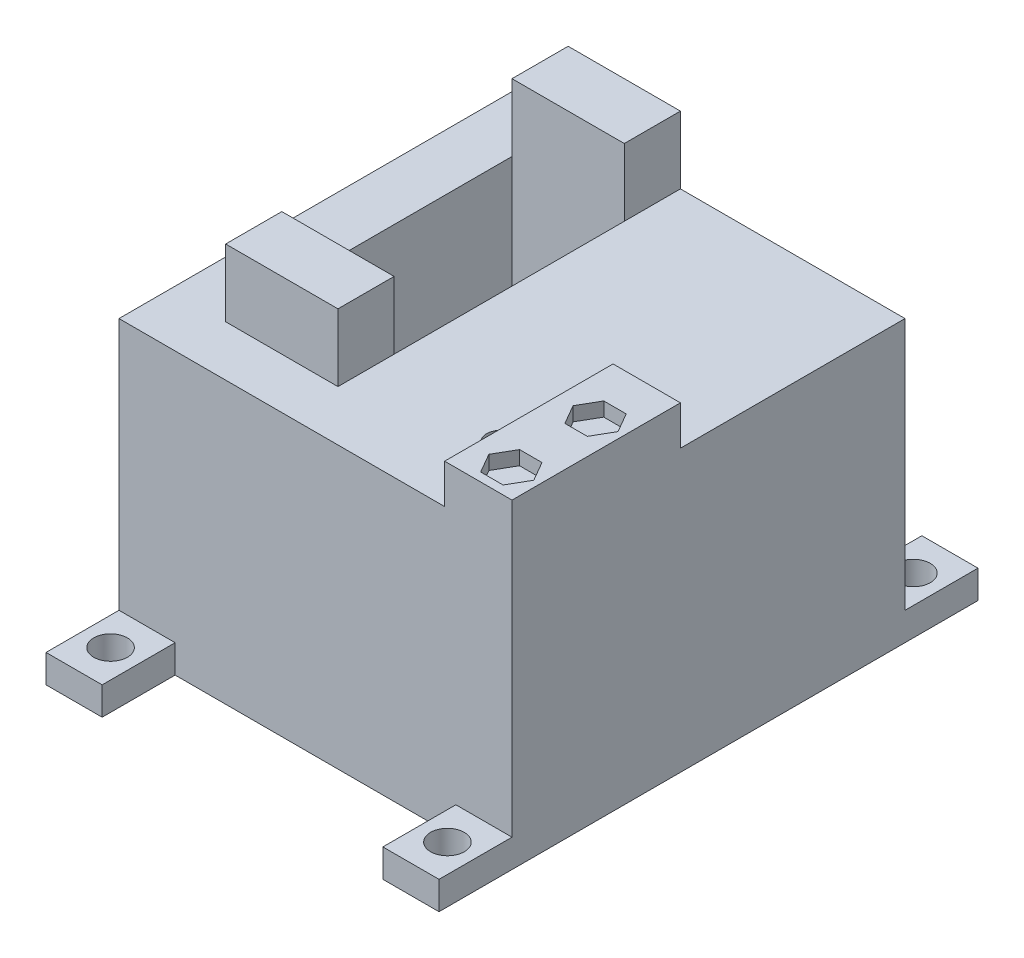
from build123d import *

# Parameters (mm, degrees)
SKETCH1_W               = 70
SKETCH1_H               = 70
BOSS_EXTRUDE1_DEPTH     = 50
CUT_EXTRUDE1_DEPTH      = 40
SKETCH3_W               = 20
SKETCH3_H               = 41
CUT_EXTRUDE2_DEPTH      = 40
SKETCH4_W               = 12
SKETCH4_H               = 30
BOSS_EXTRUDE2_DEPTH     = 7
CUT_EXTRUDE3_DEPTH      = 2.5
SKETCH7_R               = 2.5
CUT_EXTRUDE4_DEPTH      = 52.5
CUT_EXTRUDE5_DEPTH      = 97.81941954
CUT_EXTRUDE5_DEPTH_BACK = 52.5
SKETCH9_W               = 10
SKETCH9_H               = 10
SKETCH10_W              = 10
SKETCH10_H              = 6
CUT_EXTRUDE6_DEPTH      = 35
SKETCH11_W              = 20
SKETCH11_H              = 10
BOSS_EXTRUDE3_DEPTH     = 12
SKETCH13_W              = 10
SKETCH13_H              = 5
BOSS_EXTRUDE4_DEPTH     = 13
SKETCH14_W              = 10
SKETCH14_H              = 5
BOSS_EXTRUDE5_DEPTH     = 13
SKETCH15_R              = 3
CUT_EXTRUDE7_DEPTH      = 33


with BuildPart() as part:
    # Sketch1 → Boss-Extrude1 (new body)
    with BuildSketch(Plane(origin=(0, 0, 0), x_dir=(1, 0, 0), z_dir=(0, 1, 0))):
        Rectangle(SKETCH1_W, SKETCH1_H)
    extrude(amount=BOSS_EXTRUDE1_DEPTH)

    # Sketch2 → Cut-Extrude1 (cut)
    with BuildSketch(Plane.XZ):
        Polygon((0, 25), (-25, 25), (-25, -25), (25, -25), (25, 25), align=None)
    extrude(amount=-CUT_EXTRUDE1_DEPTH, mode=Mode.SUBTRACT)

    # Sketch3 → Cut-Extrude2 (cut)
    with BuildSketch(Plane(origin=(0, 50, 0), x_dir=(1, 0, 0), z_dir=(0, 1, 0))):
        with Locations((-15, 4.5)):
            Rectangle(SKETCH3_W, SKETCH3_H)
    extrude(amount=-CUT_EXTRUDE2_DEPTH, mode=Mode.SUBTRACT)

    # Sketch4 → Boss-Extrude2 (add)
    with BuildSketch(Plane(origin=(0, 50, 0), x_dir=(1, 0, 0), z_dir=(0, 1, 0))):
        with Locations((29, -20)):
            Rectangle(SKETCH4_W, SKETCH4_H)
    extrude(amount=BOSS_EXTRUDE2_DEPTH)

    # Sketch5 → Cut-Extrude3 (cut)
    with BuildSketch(Plane(origin=(0, 57, 0), x_dir=(1, 0, 0), z_dir=(0, 1, 0))):
        Polygon((33.881686691, -15), (31.881686691, -18.464101615), (27.881686691, -18.464101615), (25.881686691, -15), (27.881686691, -11.535898385), (31.881686691, -11.535898385), align=None)
        Polygon((27.881686691, -33.464101615), (25.881686691, -30), (27.881686691, -26.535898385), (31.881686691, -26.535898385), (33.881686691, -30), (31.881686691, -33.464101615), align=None)
    extrude(amount=-CUT_EXTRUDE3_DEPTH, mode=Mode.SUBTRACT)

    # Sketch7 → Cut-Extrude4 (cut)
    with BuildSketch(Plane(origin=(0, 50, 0), x_dir=(1, 0, 0), z_dir=(0, 1, 0))):
        with Locations(Location((18, -20, 0), (0, 0, 270))):
            Circle(SKETCH7_R)
    extrude(amount=-CUT_EXTRUDE4_DEPTH, mode=Mode.SUBTRACT)

    # Sketch9 → Cut-Extrude5 (cut, two sides: drawn at the far end of the back side and taken through both)
    with BuildSketch(Plane.ZY.offset(35).offset(-CUT_EXTRUDE5_DEPTH_BACK)):
        with Locations((15, 5)):
            Rectangle(SKETCH9_W, SKETCH9_H)
    extrude(amount=CUT_EXTRUDE5_DEPTH + CUT_EXTRUDE5_DEPTH_BACK, mode=Mode.SUBTRACT)

    # Sketch10 → Cut-Extrude6 (cut)
    with BuildSketch(Plane.XZ):
        with Locations((-15, -28)):
            Rectangle(SKETCH10_W, SKETCH10_H)
    extrude(amount=-CUT_EXTRUDE6_DEPTH, mode=Mode.SUBTRACT)

    # Sketch11 → Boss-Extrude3 (add)
    with BuildSketch(Plane(origin=(0, 50, 0), x_dir=(1, 0, 0), z_dir=(0, 1, 0))):
        with Locations((-15, 30)):
            Rectangle(SKETCH11_W, SKETCH11_H)
        with Locations((-15, -21)):
            Rectangle(SKETCH11_W, SKETCH11_H)
    extrude(amount=BOSS_EXTRUDE3_DEPTH)

    # Sketch13 → Boss-Extrude4 (add)
    with BuildSketch(Plane.XY.offset(35)):
        with Locations((-30, 2.5)):
            Rectangle(SKETCH13_W, SKETCH13_H)
        with Locations((30, 2.5)):
            Rectangle(SKETCH13_W, SKETCH13_H)
    extrude(amount=BOSS_EXTRUDE4_DEPTH)

    # Sketch14 → Boss-Extrude5 (add)
    with BuildSketch(Plane(origin=(0, 0, -35), x_dir=(-1, 0, 0), z_dir=(0, 0, -1))):
        with Locations((-30, 2.5)):
            Rectangle(SKETCH14_W, SKETCH14_H)
        with Locations((30, 2.5)):
            Rectangle(SKETCH14_W, SKETCH14_H)
    extrude(amount=BOSS_EXTRUDE5_DEPTH)

    # Sketch15 → Cut-Extrude7 (cut)
    with BuildSketch(Plane(origin=(0, 5, 0), x_dir=(1, 0, 0), z_dir=(0, 1, 0))):
        with Locations(Location((-29.888443239, 41.354976211, 0), (0, 0, 180))):
            Circle(SKETCH15_R)
        with Locations(Location((-30, -41.5, 0), (0, 0, 180))):
            Circle(SKETCH15_R)
        with Locations(Location((30, -41.5, 0), (0, 0, 180))):
            Circle(SKETCH15_R)
        with Locations(Location((30, 41.5, 0), (0, 0, 180))):
            Circle(SKETCH15_R)
    extrude(amount=-CUT_EXTRUDE7_DEPTH, mode=Mode.SUBTRACT)


solid = part.part
